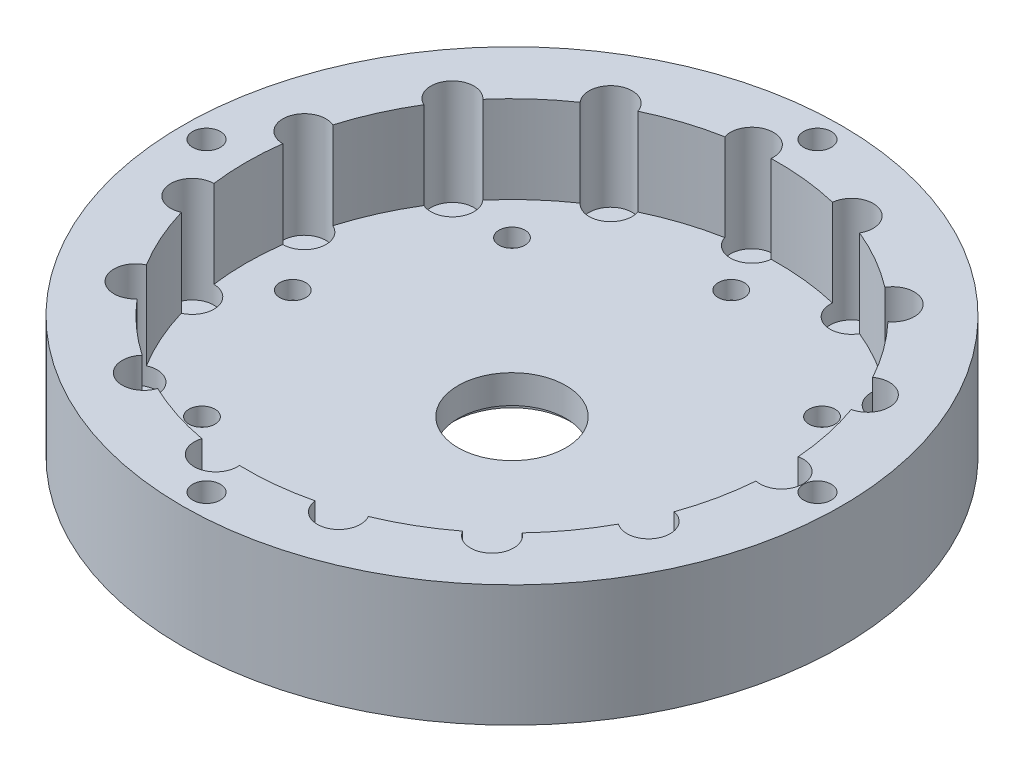
from build123d import *

# Parameters (mm, degrees)
SKETCH1_R           = 45.85
SKETCH1_R_2         = 1.5635
SKETCH1_R_3         = 7.5
BOSS_EXTRUDE1_DEPTH = 4.7625
SKETCH1_6_R         = 3
SKETCH1_6_R_2       = 1.8125
CUT_EXTRUDE1_DEPTH  = 2.5
BOSS_EXTRUDE2_START = 12.15
SKETCH1_7_R         = 45.85
SKETCH1_7_R_2       = 1.5635
BOSS_EXTRUDE2_DEPTH = 12.15
SKETCH2_R           = 1.925
CUT_EXTRUDE2_DEPTH  = 4
CUT_EXTRUDE3_START  = -3.9625
SKETCH1_8_R         = 8.25
SKETCH1_8_R_2       = 7.5
CUT_EXTRUDE3_DEPTH  = 0.8


with BuildPart() as part:
    # Sketch1 → Boss-Extrude1 (new body)
    with BuildSketch(Plane(origin=(0, 0, 0), x_dir=(1, 0, 0), z_dir=(0, 1, 0))):
        Circle(SKETCH1_R)
        with Locations((0, -42.5)):
            Circle(SKETCH1_R_2, mode=Mode.SUBTRACT)
        with Locations((-42.5, 0)):
            Circle(SKETCH1_R_2, mode=Mode.SUBTRACT)
        with Locations((42.5, 0)):
            Circle(SKETCH1_R_2, mode=Mode.SUBTRACT)
        with Locations((0, 42.5)):
            Circle(SKETCH1_R_2, mode=Mode.SUBTRACT)
        Circle(SKETCH1_R_3, mode=Mode.SUBTRACT)
    extrude(amount=-BOSS_EXTRUDE1_DEPTH)

    # Sketch1<6> → Cut-Extrude1 (cut)
    with BuildSketch(Plane(origin=(0, 0, 0), x_dir=(1, 0, 0), z_dir=(0, 1, 0))):
        with Locations((37.5, 0)):
            Circle(SKETCH1_6_R)
        with Locations((34.257954662, 15.252624115)):
            Circle(SKETCH1_6_R)
        with Locations((34.257954662, -15.252624115)):
            Circle(SKETCH1_6_R)
        with Locations((25.092397738, 27.867930955)):
            Circle(SKETCH1_6_R)
        with Locations((25.092397738, -27.867930955)):
            Circle(SKETCH1_6_R)
        with Locations((11.588137289, 35.664619361)):
            Circle(SKETCH1_6_R)
        with Locations((11.588137289, -35.664619361)):
            Circle(SKETCH1_6_R)
        with Locations((-3.919817373, 37.294571076)):
            Circle(SKETCH1_6_R)
        with Locations((-3.919817373, -37.294571076)):
            Circle(SKETCH1_6_R)
        with Locations((-18.75, 32.475952642)):
            Circle(SKETCH1_6_R)
        with Locations((-18.75, -32.475952642)):
            Circle(SKETCH1_6_R)
        with Locations((-30.338137289, 22.041946961)):
            Circle(SKETCH1_6_R)
        with Locations((-30.338137289, -22.041946961)):
            Circle(SKETCH1_6_R)
        with Locations((-36.680535028, 7.796688406)):
            Circle(SKETCH1_6_R)
        with Locations((-36.680535028, -7.796688406)):
            Circle(SKETCH1_6_R)
        with Locations((30.5, 0)):
            Circle(SKETCH1_6_R_2)
        with Locations((21.566756826, -21.566756826)):
            Circle(SKETCH1_6_R_2)
        with Locations((0, -30.5)):
            Circle(SKETCH1_6_R_2)
        with Locations((-21.566756826, -21.566756826)):
            Circle(SKETCH1_6_R_2)
        with Locations((-30.5, 0)):
            Circle(SKETCH1_6_R_2)
        with Locations((-21.566756826, 21.566756826)):
            Circle(SKETCH1_6_R_2)
        with Locations((0, 30.5)):
            Circle(SKETCH1_6_R_2)
        with Locations((21.566756826, 21.566756826)):
            Circle(SKETCH1_6_R_2)
    extrude(amount=-CUT_EXTRUDE1_DEPTH, mode=Mode.SUBTRACT)

    # Sketch1<7> → Boss-Extrude2 (add)
    with BuildSketch(Plane(origin=(0, 0, 0), x_dir=(1, 0, 0), z_dir=(0, 1, 0)).offset(BOSS_EXTRUDE2_START)):
        Circle(SKETCH1_7_R)
        with Locations((0, -42.5)):
            Circle(SKETCH1_7_R_2, mode=Mode.SUBTRACT)
        with Locations((-42.5, 0)):
            Circle(SKETCH1_7_R_2, mode=Mode.SUBTRACT)
        with Locations((42.5, 0)):
            Circle(SKETCH1_7_R_2, mode=Mode.SUBTRACT)
        with BuildLine():
            ThreePointArc((36.883333333, 2.935936345), (39.39076704, 2.32916294), (40.5, 0))
            ThreePointArc((40.5, 0), (39.39076704, -2.32916294), (36.883333333, -2.935936345))
            ThreePointArc((36.883333333, -2.935936345), (36.191461227, -7.69273256), (34.888754523, -12.319691873))
            ThreePointArc((34.888754523, -12.319691873), (36.59166411, -13.367471546), (37.257954662, -15.252624115))
            ThreePointArc((37.257954662, -15.252624115), (35.6231437, -17.924001829), (32.500448736, -17.683914497))
            ThreePointArc((32.500448736, -17.683914497), (29.933628792, -21.748054335), (26.861593101, -25.445133446))
            ThreePointArc((26.861593101, -25.445133446), (27.767055295, -26.50917897), (28.092397738, -27.867930955))
            ThreePointArc((28.092397738, -27.867930955), (25.872343464, -30.764771418), (22.497941295, -29.37418318))
            ThreePointArc((22.497941295, -29.37418318), (18.5, -32.04293994), (14.189818202, -34.170880284))
            ThreePointArc((14.189818202, -34.170880284), (14.486847583, -34.891651942), (14.588137289, -35.664619361))
            ThreePointArc((14.588137289, -35.664619361), (11.748752331, -38.660316744), (8.605335417, -35.985388734))
            ThreePointArc((8.605335417, -35.985388734), (3.867553141, -36.797310129), (-0.935505175, -36.988171489))
            ThreePointArc((-0.935505175, -36.988171489), (-0.92374189, -37.141170608), (-0.919817373, -37.294571076))
            ThreePointArc((-0.919817373, -37.294571076), (-4.385552663, -40.258199029), (-6.775211132, -36.37439366))
            ThreePointArc((-6.775211132, -36.37439366), (-11.433628792, -35.189091103), (-15.899071208, -33.409871815))
            ThreePointArc((-15.899071208, -33.409871815), (-20.25, -35.074028853), (-20.984262125, -30.47393547))
            ThreePointArc((-20.984262125, -30.47393547), (-24.757832435, -27.496358543), (-28.113543391, -24.054701786))
            ThreePointArc((-28.113543391, -24.054701786), (-32.765188272, -23.805302718), (-31.564943561, -19.304256991))
            ThreePointArc((-31.564943561, -19.304256991), (-33.801181933, -15.049255794), (-35.466928517, -10.540255288))
            ThreePointArc((-35.466928517, -10.540255288), (-39.61497783, -8.420423478), (-36.687759497, -4.796697105))
            ThreePointArc((-36.687759497, -4.796697105), (-37, 0), (-36.687759497, 4.796697105))
            ThreePointArc((-36.687759497, 4.796697105), (-39.61497783, 8.420423478), (-35.466928517, 10.540255288))
            ThreePointArc((-35.466928517, 10.540255288), (-33.801181933, 15.049255794), (-31.564943561, 19.304256991))
            ThreePointArc((-31.564943561, 19.304256991), (-32.765188272, 23.805302718), (-28.113543391, 24.054701786))
            ThreePointArc((-28.113543391, 24.054701786), (-24.757832435, 27.496358543), (-20.984262125, 30.47393547))
            ThreePointArc((-20.984262125, 30.47393547), (-20.25, 35.074028853), (-15.899071208, 33.409871815))
            ThreePointArc((-15.899071208, 33.409871815), (-11.433628792, 35.189091103), (-6.775211132, 36.37439366))
            ThreePointArc((-6.775211132, 36.37439366), (-4.385552663, 40.258199029), (-0.919817373, 37.294571076))
            ThreePointArc((-0.919817373, 37.294571076), (-0.92374189, 37.141170608), (-0.935505175, 36.988171489))
            ThreePointArc((-0.935505175, 36.988171489), (3.867553141, 36.797310129), (8.605335417, 35.985388734))
            ThreePointArc((8.605335417, 35.985388734), (11.748752331, 38.660316744), (14.588137289, 35.664619361))
            ThreePointArc((14.588137289, 35.664619361), (14.486847583, 34.891651942), (14.189818202, 34.170880284))
            ThreePointArc((14.189818202, 34.170880284), (18.5, 32.04293994), (22.497941295, 29.37418318))
            ThreePointArc((22.497941295, 29.37418318), (25.872343464, 30.764771418), (28.092397738, 27.867930955))
            ThreePointArc((28.092397738, 27.867930955), (27.767055295, 26.50917897), (26.861593101, 25.445133446))
            ThreePointArc((26.861593101, 25.445133446), (29.933628792, 21.748054335), (32.500448736, 17.683914497))
            ThreePointArc((32.500448736, 17.683914497), (35.6231437, 17.924001829), (37.257954662, 15.252624115))
            ThreePointArc((37.257954662, 15.252624115), (36.59166411, 13.367471546), (34.888754523, 12.319691873))
            ThreePointArc((34.888754523, 12.319691873), (36.191461227, 7.69273256), (36.883333333, 2.935936345))
        make_face(mode=Mode.SUBTRACT)
        with Locations((0, 42.5)):
            Circle(SKETCH1_7_R_2, mode=Mode.SUBTRACT)
    extrude(amount=-BOSS_EXTRUDE2_DEPTH)

    # Sketch2 → Cut-Extrude2 (cut)
    with BuildSketch(Plane(origin=(0, 12.15, 0), x_dir=(1, 0, 0), z_dir=(0, 1, 0))):
        with Locations((-42.5, 0)):
            Circle(SKETCH2_R)
        with Locations((0, 42.5)):
            Circle(SKETCH2_R)
        with Locations((42.5, 0)):
            Circle(SKETCH2_R)
        with Locations((0, -42.5)):
            Circle(SKETCH2_R)
    extrude(amount=-CUT_EXTRUDE2_DEPTH, mode=Mode.SUBTRACT)

    # Sketch1<8> → Cut-Extrude3 (cut)
    with BuildSketch(Plane(origin=(0, 0, 0), x_dir=(1, 0, 0), z_dir=(0, 1, 0)).offset(CUT_EXTRUDE3_START)):
        Circle(SKETCH1_8_R)
        Circle(SKETCH1_8_R_2, mode=Mode.SUBTRACT)
    extrude(amount=-CUT_EXTRUDE3_DEPTH, mode=Mode.SUBTRACT)


solid = part.part
